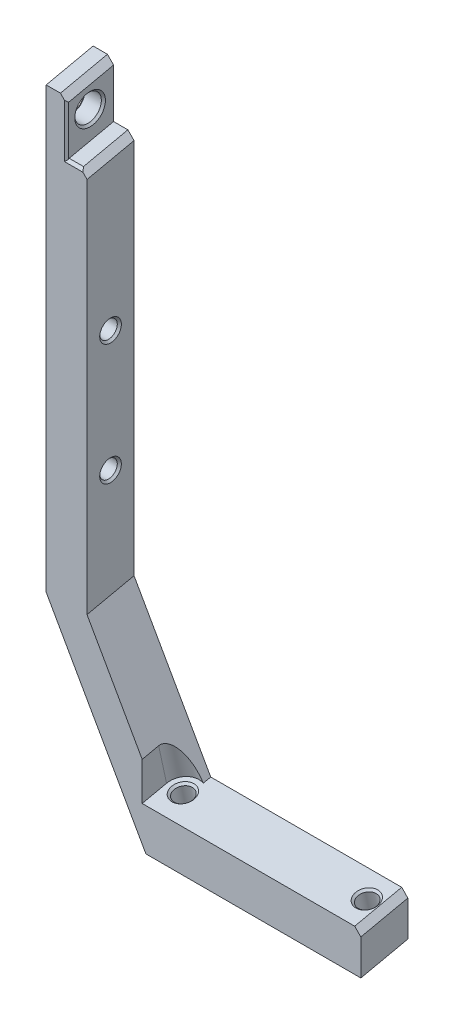
from build123d import *
from OCP.BRepFilletAPI import BRepFilletAPI_MakeChamfer

# Parameters (mm, degrees)
SKETCH4_W                       = 11.5
SKETCH4_H                       = 144
BOSS_EXTRUDE2_DEPTH             = 10
BOSS_EXTRUDE3_DEPTH             = 67
BOSS_EXTRUDE3_DEPTH_BACK        = 10
BOSS_EXTRUDE6_REACH             = 163.569
BOSS_EXTRUDE6_DIRECTION_2_REACH = 163.569
CUT_EXTRUDE2_DEPTH              = 10
SKETCH8_R                       = 2.25
CUT_EXTRUDE3_DEPTH              = 157.350124359
BOSS_EXTRUDE4_DEPTH             = 77
BOSS_EXTRUDE5_DEPTH             = 10
SKETCH14_R                      = 3.25
CUT_EXTRUDE5_DEPTH              = 10
CUT_EXTRUDE10_DEPTH             = 171.77836514
BOSS_EXTRUDE7_DEPTH             = 77
M4_CLEARANCE_HOLE1_D            = 4.3
CUT_EXTRUDE7_DEPTH              = 5
CHAMFER2_SIZE                   = 0.5
CHAMFER5_SIZE                   = 0.5
CHAMFER5_SIZE2                  = 0.653194683
CHAMFER6_SIZE                   = 1.5
CHAMFER7_SIZE                   = 1.5
CUT_EXTRUDE8_DEPTH              = 171.771365466
CUT_EXTRUDE8_DEPTH_BACK         = 171.771365466
CUT_EXTRUDE9_DEPTH              = 164.328011165
CHAMFER10_SIZE                  = 0.5


with BuildPart() as part:
    # Sketch4 → Boss-Extrude2 (new body)
    with BuildSketch(Plane(origin=(0, 0, 0), x_dir=(0, 0, -1), z_dir=(1, 0, 0))):
        with Locations((5.75, 72)):
            Rectangle(SKETCH4_W, SKETCH4_H)
    extrude(amount=BOSS_EXTRUDE2_DEPTH)

    # Sketch6 → Boss-Extrude3 (add, two sides: drawn at the far end of the back side and taken through both)
    with BuildSketch(Plane(origin=(10, 0, 0), x_dir=(0, 0, -1), z_dir=(1, 0, 0)).offset(-BOSS_EXTRUDE3_DEPTH_BACK)):
        Polygon((5.75, 0), (11.5, 1.246345792), (9.381634588, 11.019396901), (-0.391416521, 8.901031488), (1.726948891, -0.872019621), align=None)
    extrude(amount=BOSS_EXTRUDE3_DEPTH + BOSS_EXTRUDE3_DEPTH_BACK)

    # Boss-Extrude6: up to this face of the body (flat: up to its plane)
    boss_extrude6_end = Plane(part.part.faces().sort_by_distance((5, 72, -11.5))[0])
    # Sketch26 → Boss-Extrude6 (add, up to the picked face)
    with BuildSketch(Plane(origin=(0, 2.436762164, -11.241970359), x_dir=(-1, 0, 0), z_dir=(0, 0.2118365412295611, -0.977305110904418)), mode=Mode.PRIVATE) as boss_extrude6_sk1:
        Polygon((-23, -1.218060112), (0, 38.619108462), (-8.660254038, 43.619108462), (-31.660254038, 3.781939888), align=None)
    boss_extrude6_tool1 = split(extrude(boss_extrude6_sk1.sketch, amount=BOSS_EXTRUDE6_REACH, mode=Mode.PRIVATE), bisect_by=boss_extrude6_end, keep=Keep.BOTH, mode=Mode.PRIVATE)
    add(boss_extrude6_tool1.solids().sort_by(Axis((15.830127, 23.156143, -6.750925), (0, 0.2118365412295611, -0.977305110904418)))[0])

    # Boss-Extrude6 direction 2: up to this face of the body (flat: up to its plane)
    boss_extrude6_direction_2_end = Plane(part.part.faces().sort_by_distance((5, 3.547618245, 0))[0])
    # Sketch26 → Boss-Extrude6 direction 2 (add, up to the picked face)
    with BuildSketch(Plane(origin=(0, 2.436762164, -11.241970359), x_dir=(-1, 0, 0), z_dir=(0, 0.2118365412295611, -0.977305110904418)), mode=Mode.PRIVATE) as boss_extrude6_direction_2_sk1:
        Polygon((-23, -1.218060112), (0, 38.619108462), (-8.660254038, 43.619108462), (-31.660254038, 3.781939888), align=None)
    boss_extrude6_direction_2_tool1 = split(extrude(boss_extrude6_direction_2_sk1.sketch, amount=-BOSS_EXTRUDE6_DIRECTION_2_REACH, mode=Mode.PRIVATE), bisect_by=boss_extrude6_direction_2_end, keep=Keep.BOTH, mode=Mode.PRIVATE)
    add(boss_extrude6_direction_2_tool1.solids().sort_by(Axis((15.830127, 23.156143, -6.750925), (0, -0.2118365412295611, 0.977305110904418)))[0])

    # Sketch7 → Cut-Extrude2 (cut)
    with BuildSketch(Plane(origin=(10, 0, 0), x_dir=(0, 0, -1), z_dir=(1, 0, 0))):
        Polygon((-2.972783549, -1.890713838), (11.820921466, -3.029043446), (11.820921466, 1.315907377), align=None)
    extrude(amount=-CUT_EXTRUDE2_DEPTH, mode=Mode.SUBTRACT)

    # Sketch8 → Cut-Extrude3 (cut, through all)
    with BuildSketch(Plane(origin=(0, 8.582634736, 1.860335771), x_dir=(1, 0, 0), z_dir=(0, 0.977305110904418, 0.2118365412295613))):
        with Locations(Location((72.5, 8.003030357, 0), (0, 0, 270))):
            Circle(SKETCH8_R)
        with Locations(Location((27.5, 8.003030357, 0), (0, 0, 304.471845094))):
            Circle(SKETCH8_R)
    extrude(amount=-CUT_EXTRUDE3_DEPTH, mode=Mode.SUBTRACT)

    # Sketch12 → Boss-Extrude4 (add)
    with BuildSketch(Plane(origin=(77, 0, 0), x_dir=(0, 0, -1), z_dir=(1, 0, 0))):
        Polygon((1.726948891, -0.872019621), (0, -1.246345792), (0, 7.095236489), align=None)
    extrude(amount=-BOSS_EXTRUDE4_DEPTH)

    # Sketch13 → Boss-Extrude5 (add)
    with BuildSketch(Plane(origin=(10, 0, 0), x_dir=(0, 0, -1), z_dir=(1, 0, 0))):
        Polygon((11.5, 144), (11.5, 152), (0, 149.507308417), (0, 144), align=None)
    extrude(amount=-BOSS_EXTRUDE5_DEPTH)

    # Sketch14 → Cut-Extrude5 (cut)
    with BuildSketch(Plane(origin=(10, 0, 0), x_dir=(0, 0, -1), z_dir=(1, 0, 0))):
        with Locations((5.75, 144)):
            Circle(SKETCH14_R)
    extrude(amount=-CUT_EXTRUDE5_DEPTH, mode=Mode.SUBTRACT)

    # Sketch29 → Cut-Extrude10 (cut, through all)
    with BuildSketch(Plane(origin=(77, 0, 0), x_dir=(0, 0, -1), z_dir=(1, 0, 0))):
        Polygon((0, 7.095236489), (0, 8.985873286), (-0.391416521, 8.901031488), align=None)
    extrude(amount=-CUT_EXTRUDE10_DEPTH, mode=Mode.SUBTRACT)

    # Sketch31 → Boss-Extrude7 (add)
    with BuildSketch(Plane(origin=(77, 0, 0), x_dir=(0, 0, -1), z_dir=(1, 0, 0))):
        Polygon((11.5, 1.246345792), (9.381634588, 11.019396901), (11.5, 11.478564869), align=None)
    extrude(amount=-BOSS_EXTRUDE7_DEPTH)

    # M4 Clearance Hole1 (through all)
    with Locations(Plane(origin=(10, 0, 0), x_dir=(0, 0, -1), z_dir=(1, 0, 0))):
        with Locations((5.75, 70), (5.75, 99.6)):
            Hole(M4_CLEARANCE_HOLE1_D / 2)

    # Sketch24 → Cut-Extrude7 (cut)
    with BuildSketch(Plane(origin=(10, 0, 0), x_dir=(0, 0, -1), z_dir=(1, 0, 0))):
        Polygon((11.5, 152), (0, 149.507308417), (0, 136), (11.5, 138.492691583), align=None)
    extrude(amount=-CUT_EXTRUDE7_DEPTH, mode=Mode.SUBTRACT)

    # Chamfer2
    chamfer2_edges = [part.edges().sort_by_distance(p)[0] for p in [
        (72.5, 10.754601224, -8.160003199),
        (0, 144, -2.5),
        (10, 99.6, -7.9),
        (0, 99.6, -7.9),
        (10, 70, -7.9),
        (0, 70, -7.9),
        (5, 144, -2.5),
        (72.5, 0.981550115, -10.278368611),
    ]]
    chamfer(chamfer2_edges, length=CHAMFER2_SIZE)

    # Chamfer5: one chamfer whose edges measure the first distance from different faces: ONE call of the kernel's chamfer builder (chamfer() names one face for all edges)
    chamfer5_edges_1 = [part.edges().sort_by_distance(p)[0] for p in [
        (5, 142.753654208, 0),
    ]]
    chamfer5_edges_2 = [part.edges().sort_by_distance(p)[0] for p in [
        (7.5, 136, 0),
    ]]
    chamfer5_side_2 = [part.faces().sort_by_distance(p)[0] for p in [
        (75.307201599, 3.869763747, 0),
    ]]
    chamfer5 = BRepFilletAPI_MakeChamfer(part.part.solid().wrapped)
    for e in chamfer5_edges_1:
        chamfer5.Add(CHAMFER5_SIZE, e.wrapped)
    for e in chamfer5_edges_2:
        chamfer5.Add(CHAMFER5_SIZE, CHAMFER5_SIZE2, e.wrapped, chamfer5_side_2[0].wrapped)  # the first distance lies on this face
    add(Compound.cast(chamfer5.Shape()), mode=Mode.REPLACE)

    # Chamfer6
    chamfer6_edges = [part.edges().sort_by_distance(p)[0] for p in [
        (5, 150.807843156, -6),
        (10, 137.315531043, -6.069185251),
    ]]
    chamfer(chamfer6_edges, length=CHAMFER6_SIZE)

    # Chamfer7
    chamfer7_edges = [part.edges().sort_by_distance(p)[0] for p in [
        (77, 10.232219077, -5.75),
    ]]
    chamfer(chamfer7_edges, length=CHAMFER7_SIZE)

    # Sketch28 → Cut-Extrude8 (cut, two sides: drawn at the far end of the back side and taken through both)
    with BuildSketch(Plane(origin=(0, 0.007864469, -11.5), x_dir=(-1, 0, 0), z_dir=(0, 0, 1)).offset(-CUT_EXTRUDE8_DEPTH_BACK)):
        Polygon((-215.508836101, 339.939602485), (8.299010344, 9.244852129), (8.299010344, -56.708851361), align=None)
    extrude(amount=CUT_EXTRUDE8_DEPTH + CUT_EXTRUDE8_DEPTH_BACK, mode=Mode.SUBTRACT)

    # Sketch11 → Cut-Extrude9 (cut, through all)
    with BuildSketch(Plane(origin=(0, 8.582634736, 1.860335771), x_dir=(1, 0, 0), z_dir=(0, 0.977305110904418, 0.2118365412295613))):
        with BuildLine():
            Line((23.5, 8.003030357), (23.5, 0))
            Line((23.5, 0), (31.5, 0))
            Line((31.5, 0), (31.5, 8.003030357))
            ThreePointArc((31.5, 8.003030357), (27.5, 12.003030357), (23.5, 8.003030357))
        make_face()
    extrude(amount=CUT_EXTRUDE9_DEPTH, mode=Mode.SUBTRACT)

    # Chamfer10
    chamfer10_edges = [part.edges().sort_by_distance(p)[0] for p in [
        (26.226497308, 0.897855604, -9.892245079),
        (26.226497308, 10.670906713, -7.773879666),
    ]]
    chamfer(chamfer10_edges, length=CHAMFER10_SIZE)


solid = part.part
